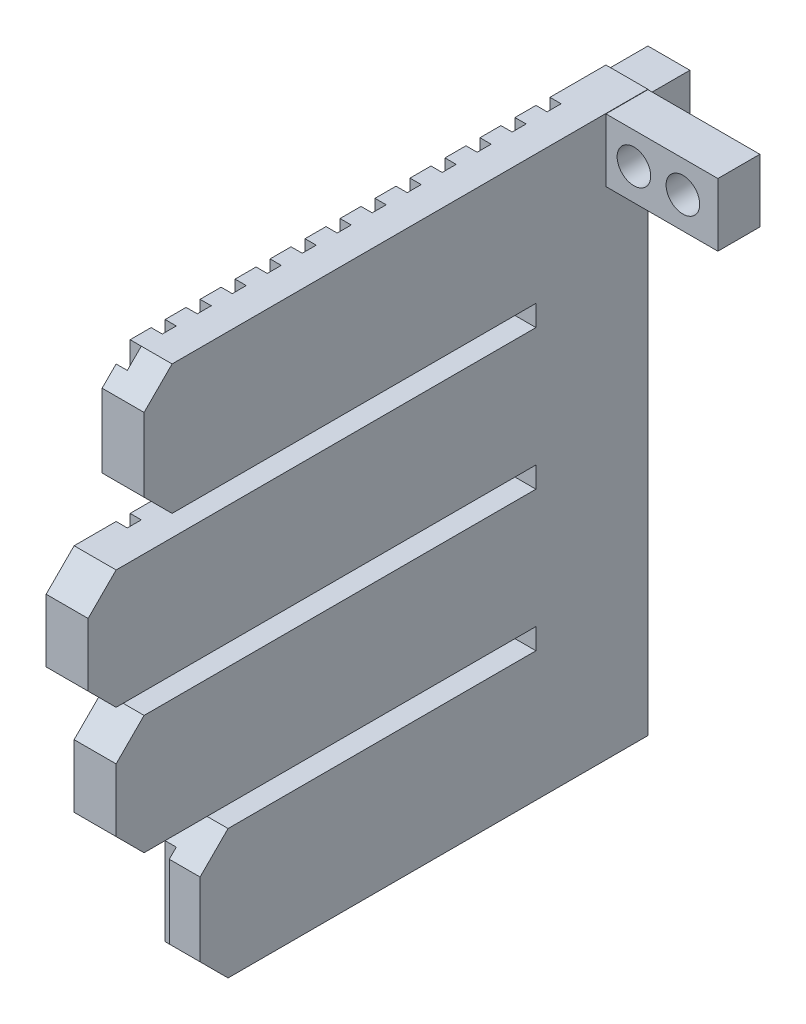
from build123d import *

# Parameters (mm, degrees)
BOSS_EXTRUDE1_START     = 25
SKETCH1_W               = 3
SKETCH1_H               = 40
BOSS_EXTRUDE1_DEPTH     = 8
BOSS_EXTRUDE2_START     = 32.5
SKETCH2_W               = 3
SKETCH2_H               = 9.25
SKETCH2_H_2             = 8.5
BOSS_EXTRUDE2_DEPTH     = 32.5
BOSS_EXTRUDE3_START     = 25
SKETCH3_W               = 8
SKETCH3_H               = 4.5
BOSS_EXTRUDE3_DEPTH     = 3
BOSS_EXTRUDE4_START     = 22
SKETCH4_W               = 3
SKETCH4_H               = 3.9
BOSS_EXTRUDE4_DEPTH     = 3
CUT_EXTRUDE1_DEPTH      = 72.175838597
CUT_EXTRUDE1_DEPTH_BACK = 72.175838597
SKETCH5_R               = 1.2
CUT_EXTRUDE2_DEPTH      = 72.175838597
CUT_EXTRUDE2_DEPTH_BACK = 72.175838597
SKETCH6_W               = 1.8
SKETCH6_H               = 1
CUT_EXTRUDE3_DEPTH      = 72.175838597
CUT_EXTRUDE3_DEPTH_BACK = 72.175838597
SKETCH7_W               = 9
SKETCH7_H               = 10.65
SKETCH7_W_2             = 7
SKETCH7_H_2             = 9.9
SKETCH7_W_3             = 13
CUT_EXTRUDE4_DEPTH      = 72.175838597
CUT_EXTRUDE4_DEPTH_BACK = 72.175838597


with BuildPart() as part:
    # Sketch1 → Boss-Extrude1 (new body)
    with BuildSketch(Plane.XY.offset(BOSS_EXTRUDE1_START)):
        with Locations((11.5, 0)):
            Rectangle(SKETCH1_W, SKETCH1_H)
    extrude(amount=BOSS_EXTRUDE1_DEPTH)

    # Sketch2 → Boss-Extrude2 (add)
    with BuildSketch(Plane.XY.offset(BOSS_EXTRUDE2_START)):
        with Locations((11.5, 15.375)):
            Rectangle(SKETCH2_W, SKETCH2_H)
        with Locations((11.5, 5)):
            Rectangle(SKETCH2_W, SKETCH2_H_2)
        with Locations((11.5, -5)):
            Rectangle(SKETCH2_W, SKETCH2_H_2)
        with Locations((11.5, -15.375)):
            Rectangle(SKETCH2_W, SKETCH2_H)
    extrude(amount=BOSS_EXTRUDE2_DEPTH)

    # Sketch3 → Boss-Extrude3 (add)
    with BuildSketch(Plane.XY.offset(BOSS_EXTRUDE3_START)):
        with Locations((17, 17.725)):
            Rectangle(SKETCH3_W, SKETCH3_H)
    extrude(amount=BOSS_EXTRUDE3_DEPTH)

    # Sketch4 → Boss-Extrude4 (add)
    with BuildSketch(Plane.XY.offset(BOSS_EXTRUDE4_START)):
        with Locations((11.5, 17.725)):
            Rectangle(SKETCH4_W, SKETCH4_H)
    extrude(amount=BOSS_EXTRUDE4_DEPTH)

    # Sketch5 → Cut-Extrude1 (cut, two sides: drawn at the far end of the back side and taken through both)
    with BuildSketch(Plane.XY.offset(-CUT_EXTRUDE1_DEPTH_BACK)):
        with Locations((15, 17.725)):
            Circle(SKETCH5_R)
        with Locations((18.5, 17.725)):
            Circle(SKETCH5_R)
    extrude(amount=CUT_EXTRUDE1_DEPTH + CUT_EXTRUDE1_DEPTH_BACK, mode=Mode.SUBTRACT)

    # Sketch6 → Cut-Extrude2 (cut, two sides: drawn at the far end of the back side and taken through both)
    with BuildSketch(Plane(origin=(0, 0, 0), x_dir=(1, 0, 0), z_dir=(0, 1, 0)).offset(-CUT_EXTRUDE2_DEPTH_BACK)):
        with Locations((9.9, -29.5)):
            Rectangle(SKETCH6_W, SKETCH6_H)
        with Locations((9.9, -32)):
            Rectangle(SKETCH6_W, SKETCH6_H)
        with Locations((9.9, -34.5)):
            Rectangle(SKETCH6_W, SKETCH6_H)
        with Locations((9.9, -37)):
            Rectangle(SKETCH6_W, SKETCH6_H)
        with Locations((9.9, -39.5)):
            Rectangle(SKETCH6_W, SKETCH6_H)
        with Locations((9.9, -42)):
            Rectangle(SKETCH6_W, SKETCH6_H)
        with Locations((9.9, -44.5)):
            Rectangle(SKETCH6_W, SKETCH6_H)
        with Locations((9.9, -47)):
            Rectangle(SKETCH6_W, SKETCH6_H)
        with Locations((9.9, -49.5)):
            Rectangle(SKETCH6_W, SKETCH6_H)
        with Locations((9.9, -52)):
            Rectangle(SKETCH6_W, SKETCH6_H)
        with Locations((9.9, -54.5)):
            Rectangle(SKETCH6_W, SKETCH6_H)
        with Locations((9.9, -57)):
            Rectangle(SKETCH6_W, SKETCH6_H)
        with Locations((9.9, -59.5)):
            Rectangle(SKETCH6_W, SKETCH6_H)
    extrude(amount=CUT_EXTRUDE2_DEPTH + CUT_EXTRUDE2_DEPTH_BACK, mode=Mode.SUBTRACT)

    # Sketch7 → Cut-Extrude3 (cut, two sides: drawn at the far end of the back side and taken through both)
    with BuildSketch(Plane(origin=(0, 0, 0), x_dir=(0, 0, -1), z_dir=(1, 0, 0)).offset(-CUT_EXTRUDE3_DEPTH_BACK)):
        with Locations((-65.5, 15.375)):
            Rectangle(SKETCH7_W, SKETCH7_H)
        with Locations((-66.5, -5)):
            Rectangle(SKETCH7_W_2, SKETCH7_H_2)
        with Locations((-63.5, -15.375)):
            Rectangle(SKETCH7_W_3, SKETCH7_H)
    extrude(amount=CUT_EXTRUDE3_DEPTH + CUT_EXTRUDE3_DEPTH_BACK, mode=Mode.SUBTRACT)

    # Sketch8 → Cut-Extrude4 (cut, two sides: drawn at the far end of the back side and taken through both)
    with BuildSketch(Plane(origin=(0, 0, 0), x_dir=(0, 0, -1), z_dir=(1, 0, 0)).offset(-CUT_EXTRUDE4_DEPTH_BACK)):
        Polygon((-58.3, 10.05), (-62, 10.05), (-62, 13.75), align=None)
        Polygon((-58.3, 20.7), (-62, 17), (-62, 20.7), align=None)
        Polygon((-62.3, 0.05), (-66, 0.05), (-66, 3.75), align=None)
        Polygon((-62.3, 9.95), (-66, 6.25), (-66, 9.95), align=None)
        Polygon((-60.3, -9.95), (-64, -9.95), (-64, -6.25), align=None)
        Polygon((-60.3, -0.05), (-64, -3.75), (-64, -0.05), align=None)
        Polygon((-54.3, -20.7), (-58, -20.7), (-58, -17), align=None)
        Polygon((-54.3, -10.05), (-58, -13.75), (-58, -10.05), align=None)
    extrude(amount=CUT_EXTRUDE4_DEPTH + CUT_EXTRUDE4_DEPTH_BACK, mode=Mode.SUBTRACT)


solid = part.part
